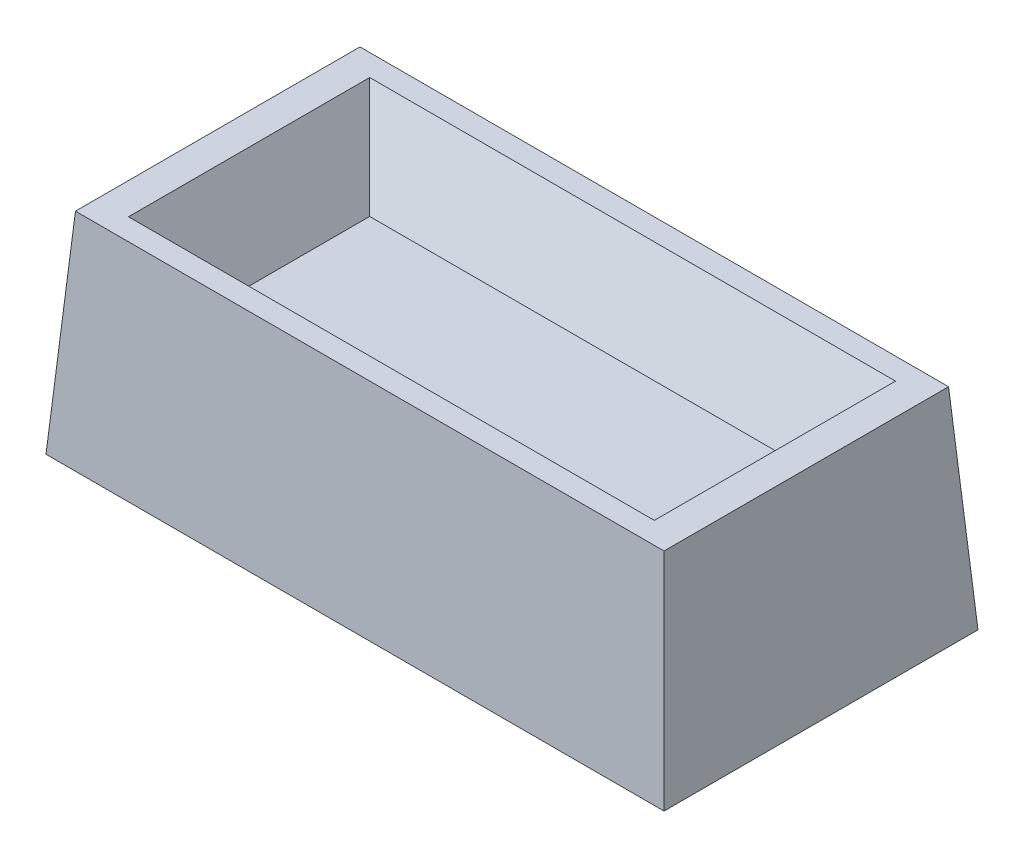
from build123d import *

# Parameters (mm, degrees)
SKETCH1_W           = 205.785682804
SKETCH1_H           = 104.534748446
BOSS_EXTRUDE1_DEPTH = 70.104
BOSS_EXTRUDE1_TAPER = 4
SKETCH2_W           = 145.758865666
SKETCH2_H           = 50.974097726
CUT_EXTRUDE1_DEPTH  = 25.4
DRAFT1_ANGLE        = 30
SHELL1_T            = -1.5875


with BuildPart() as part:
    # Sketch1 → Boss-Extrude1 (new body)
    with BuildSketch(Plane(origin=(0, 0, 0), x_dir=(1, 0, 0), z_dir=(0, 1, 0))):
        Rectangle(SKETCH1_W, SKETCH1_H)
    extrude(amount=BOSS_EXTRUDE1_DEPTH, taper=BOSS_EXTRUDE1_TAPER)

    # Sketch2 → Cut-Extrude1 (cut)
    with BuildSketch(Plane(origin=(0, 70.104, 0), x_dir=(1, 0, 0), z_dir=(0, 1, 0))):
        Rectangle(SKETCH2_W, SKETCH2_H)
    extrude(amount=-CUT_EXTRUDE1_DEPTH, mode=Mode.SUBTRACT)

    # Draft1
    draft1_faces = [part.faces().sort_by_distance(p)[0] for p in [
        (0, 57.404, 25.487048863),
        (72.879432833, 57.404, 0),
        (0, 57.404, -25.487048863),
        (-72.879432833, 57.404, 0),
    ]]
    draft(draft1_faces, Plane.ZX.offset(44.704), DRAFT1_ANGLE)

    # Shell1
    shell1_openings = [part.faces().sort_by_distance(p)[0] for p in [
        (0, 0, 0),
    ]]
    offset(amount=SHELL1_T, openings=shell1_openings, kind=Kind.INTERSECTION)


solid = part.part
